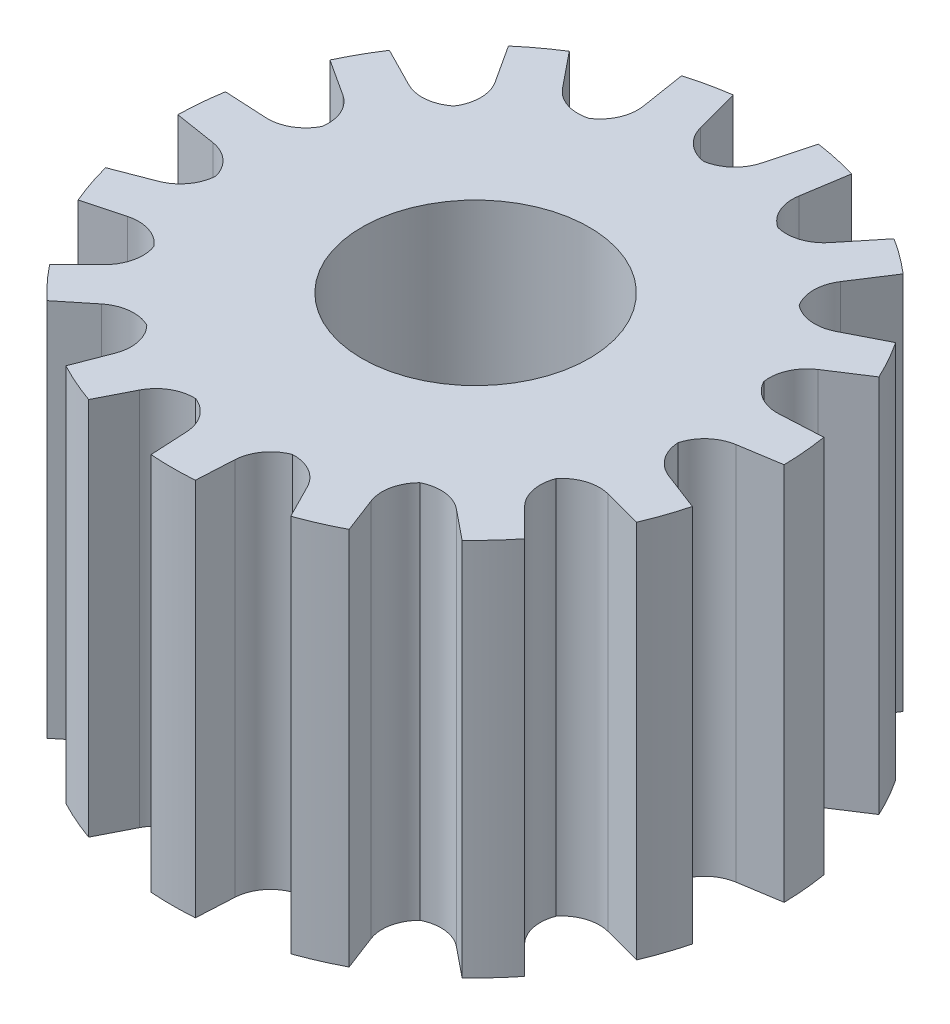
from build123d import *

# Parameters (mm, degrees)
ESQUISSE1_R                  = 20
BOSS_EXTRU_1_DEPTH           = 25
ENL_V_MAT_EXTRU_1_REACH      = 39.749
R_P_TITION_CIRCULAIRE1_COUNT = 15
ENL_V_MAT_EXTRU_2_REACH      = 39.747
ESQUISSE5_R                  = 7.5


with BuildPart() as part:
    # Esquisse1 → Boss.-Extru.1 (new body)
    with BuildSketch(Plane(origin=(0, 0, 0), x_dir=(1, 0, 0), z_dir=(0, 1, 0))):
        with Locations(Location((0, 0, 0), (0, 0, 270))):
            Circle(ESQUISSE1_R)
    extrude(amount=BOSS_EXTRU_1_DEPTH)

    # Esquisse3 → Enlèv. mat.-Extru.1 (cut, up to next)
    with BuildSketch(Plane(origin=(0, 25, 0), x_dir=(1, 0, 0), z_dir=(0, 1, 0)), mode=Mode.PRIVATE) as enl_v_mat_extru_1_sk1:
        with BuildLine():
            ThreePointArc((2.80685469, 19.802059659), (0, 20), (-2.80685469, 19.802059659))
            Line((-2.80685469, 19.802059659), (-2.015422429, 16.848394249))
            ThreePointArc((-2.015422429, 16.848394249), (-1.276557591, 15.640396711), (0, 15.027550875))
            ThreePointArc((0, 15.027550875), (1.276557591, 15.640396711), (2.015422429, 16.848394249))
            Line((2.015422429, 16.848394249), (2.80685469, 19.802059659))
        make_face()
    enl_v_mat_extru_1_tool1 = extrude(enl_v_mat_extru_1_sk1.sketch, amount=-ENL_V_MAT_EXTRU_1_REACH, mode=Mode.PRIVATE) & part.part
    enl_v_mat_extru_1 = enl_v_mat_extru_1_tool1.solids().sort_by_distance((0, 25, -17.875874))[0]
    add(enl_v_mat_extru_1, mode=Mode.SUBTRACT)

    # Répétition circulaire1: Enlèv. mat.-Extru.1 ×15 about axis
    r_p_tition_circulaire1_axis = Axis((0, 0, 0.291044728), (0, 1, 0))
    for i in range(1, R_P_TITION_CIRCULAIRE1_COUNT):
        add(enl_v_mat_extru_1.rotate(r_p_tition_circulaire1_axis, i * 360 / R_P_TITION_CIRCULAIRE1_COUNT), mode=Mode.SUBTRACT)

    # Esquisse5 → Enlèv. mat.-Extru.2 (cut, up to next)
    with BuildSketch(Plane(origin=(0, 25, 0), x_dir=(1, 0, 0), z_dir=(0, 1, 0)), mode=Mode.PRIVATE) as enl_v_mat_extru_2_sk1:
        with Locations(Location((0, 0, 0), (0, 0, 270))):
            Circle(ESQUISSE5_R)
    enl_v_mat_extru_2_tool1 = extrude(enl_v_mat_extru_2_sk1.sketch, amount=-ENL_V_MAT_EXTRU_2_REACH, mode=Mode.PRIVATE) & part.part
    add(enl_v_mat_extru_2_tool1.solids().sort_by_distance((0, 25, 0))[0], mode=Mode.SUBTRACT)


solid = part.part
